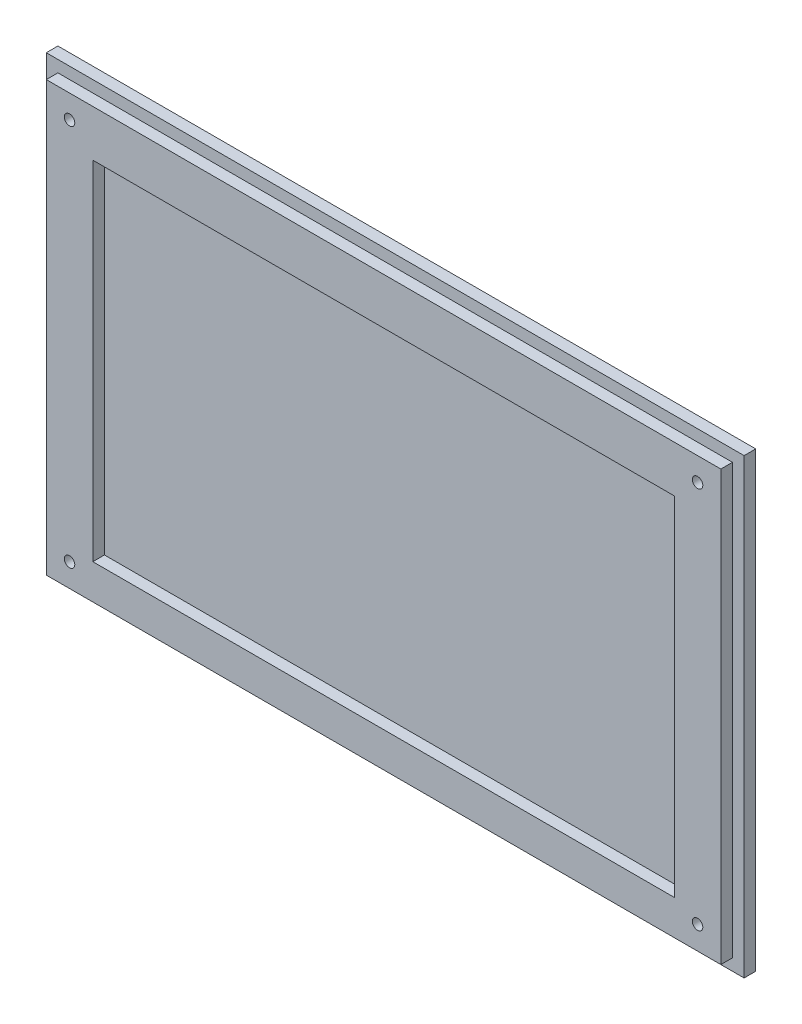
from build123d import *

# Parameters (mm, degrees)
SKIZZE1_W                                           = 300
SKIZZE1_H                                           = 194.5
AUFSATZ_LINEAR_AUSTRAGEN1_DEPTH                     = 5
SKIZZE2_W                                           = 290
SKIZZE2_H                                           = 184.5
SKIZZE2_W_2                                         = 250
SKIZZE2_H_2                                         = 149.5
AUFSATZ_LINEAR_AUSTRAGEN2_DEPTH                     = 5
STIRNSENKUNG_F_R_M4_SENKSCHRAUBE_KOPF_B_D           = 4.5
STIRNSENKUNG_F_R_M4_SENKSCHRAUBE_KOPF_B_CBORE_D     = 8.6
STIRNSENKUNG_F_R_M4_SENKSCHRAUBE_KOPF_B_CBORE_DEPTH = 2.2
SPIEGELN2_COPY_1_D                                  = 4.5
SPIEGELN2_COPY_1_CBORE_D                            = 8.6
SPIEGELN2_COPY_1_CBORE_DEPTH                        = 2.2


with BuildPart() as part:
    # Skizze1 → Aufsatz-Linear austragen1 (new body)
    with BuildSketch(Plane.XY):
        with Locations((19.733299505, 1.797169811)):
            Rectangle(SKIZZE1_W, SKIZZE1_H)
    extrude(amount=AUFSATZ_LINEAR_AUSTRAGEN1_DEPTH)

    # Skizze2 → Aufsatz-Linear austragen2 (add)
    with BuildSketch(Plane.XY.offset(5)):
        with Locations((19.733299505, 1.797169811)):
            Rectangle(SKIZZE2_W, SKIZZE2_H)
        with Locations((19.733299505, -0.702830189)):
            Rectangle(SKIZZE2_W_2, SKIZZE2_H_2, mode=Mode.SUBTRACT)
    extrude(amount=AUFSATZ_LINEAR_AUSTRAGEN2_DEPTH)

    # Stirnsenkung für M4 Senkschraube (Kopf Button)1 (through all)
    with Locations(Plane(origin=(0, 0, 0), x_dir=(-1, 0, 0), z_dir=(0, 0, -1))):
        with Locations((115.266700495, 84.047169811)):
            stirnsenkung_f_r_m4_senkschraube_kopf_b = CounterBoreHole(STIRNSENKUNG_F_R_M4_SENKSCHRAUBE_KOPF_B_D / 2, STIRNSENKUNG_F_R_M4_SENKSCHRAUBE_KOPF_B_CBORE_D / 2, STIRNSENKUNG_F_R_M4_SENKSCHRAUBE_KOPF_B_CBORE_DEPTH)

    # Spiegeln1: Stirnsenkung für M4 Senkschraube (Kopf Button)1 across plane
    add(stirnsenkung_f_r_m4_senkschraube_kopf_b.mirror(Plane.ZX.offset(1.797169811)), mode=Mode.SUBTRACT)

    # Spiegeln2: Stirnsenkung für M4 Senkschraube (Kopf Button)1 across plane
    add(stirnsenkung_f_r_m4_senkschraube_kopf_b.mirror(Plane(origin=(19.733299505, 0, 0), x_dir=(0, 0, 1), z_dir=(1, 0, 0))), mode=Mode.SUBTRACT)

    # Spiegeln2 copy 1 (through all)
    with Locations(Plane(origin=(39.46659901, 3.594339623, 0), x_dir=(1, 0, 0), z_dir=(0, 0, -1))):
        with Locations((115.266700495, 84.047169811)):
            CounterBoreHole(SPIEGELN2_COPY_1_D / 2, SPIEGELN2_COPY_1_CBORE_D / 2, SPIEGELN2_COPY_1_CBORE_DEPTH)


solid = part.part
